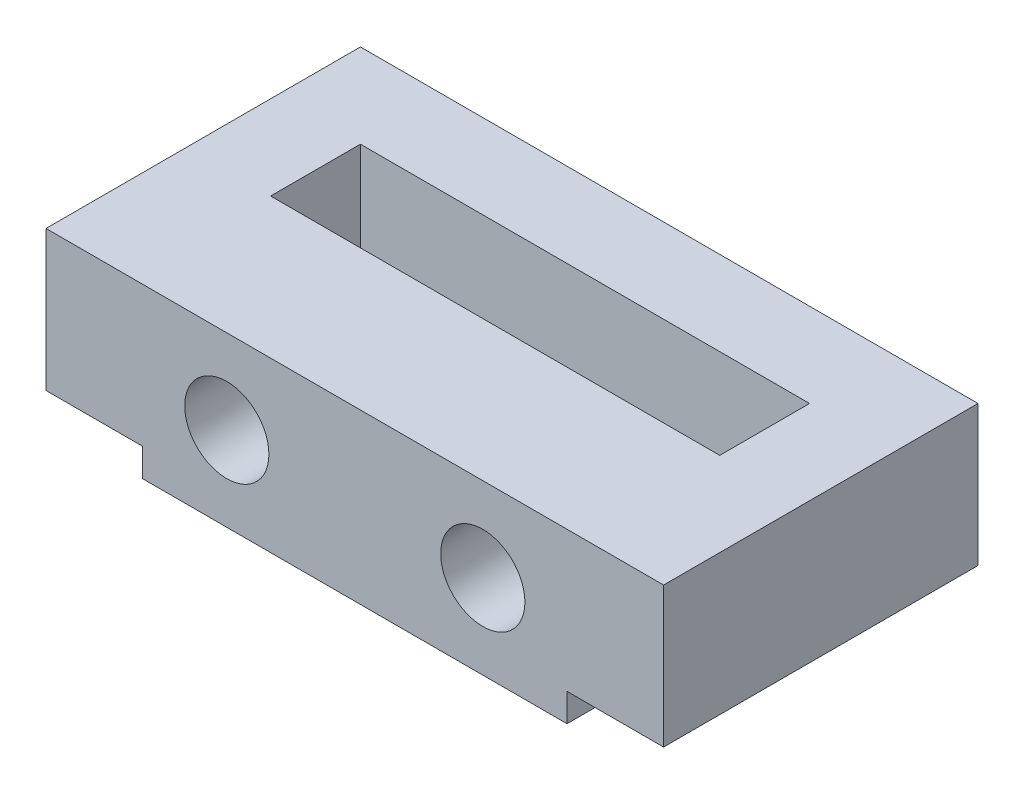
from build123d import *

# Parameters (mm, degrees)
SKETCH_1_W      = 15.12
SKETCH_1_H      = 6
SKETCH_1_R      = 1.5
EXTRUDE_1_DEPTH = 5
EXTRUDE_2_DEPTH = 5


with BuildPart() as part:
    # Эскиз1 → Бобышка-Вытянуть1 (new body)
    with BuildSketch(Plane.XY):
        with Locations((4.56, 0)):
            Rectangle(SKETCH_1_W, SKETCH_1_H)
        Circle(SKETCH_1_R, mode=Mode.SUBTRACT)
        with Locations((9.12, 0)):
            Circle(SKETCH_1_R, mode=Mode.SUBTRACT)
    extrude(amount=EXTRUDE_1_DEPTH)

    # Эскиз2 → Бобышка-Вытянуть2 (add)
    with BuildSketch(Plane(origin=(0, 3, 0), x_dir=(1, 0, 0), z_dir=(0, 1, 0))):
        Polygon((12.12, -5), (15.56, -5), (15.56, 6.2), (-6.44, 6.2), (-6.44, -5), (-3, -5), (-3, 0), (-3.44, 0), (-3.44, 3.2), (12.56, 3.2), (12.56, 0), (12.12, 0), align=None)
    extrude(amount=-EXTRUDE_2_DEPTH)


solid = part.part
